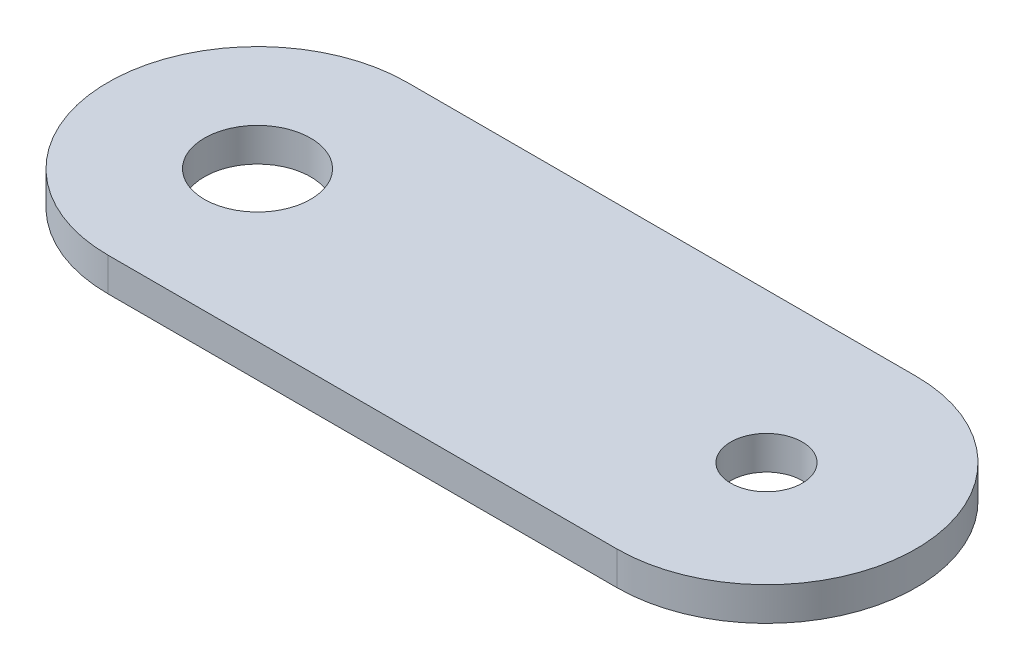
from build123d import *

# Parameters (mm, degrees)
SKETCH1_R           = 6.332069854
SKETCH1_R_2         = 4.265422869
BOSS_EXTRUDE1_DEPTH = 4


with BuildPart() as part:
    # Sketch1 → Boss-Extrude1 (new body)
    with BuildSketch(Plane(origin=(0, 0, 0), x_dir=(1, 0, 0), z_dir=(0, 1, 0))):
        with BuildLine():
            Line((0, 17.841416209), (60.704762448, 17.841416209))
            ThreePointArc((60.704762448, 17.841416209), (78.546178657, 0), (60.704762448, -17.841416209))
            Line((60.704762448, -17.841416209), (0, -17.841416209))
            ThreePointArc((0, -17.841416209), (-17.841416209, 0), (0, 17.841416209))
        make_face()
        with Locations(Location((0, 0, 0), (0, 0, 270))):
            Circle(SKETCH1_R, mode=Mode.SUBTRACT)
        with Locations(Location((60.704762448, 0, 0), (0, 0, 270))):
            Circle(SKETCH1_R_2, mode=Mode.SUBTRACT)
    extrude(amount=BOSS_EXTRUDE1_DEPTH)


solid = part.part
